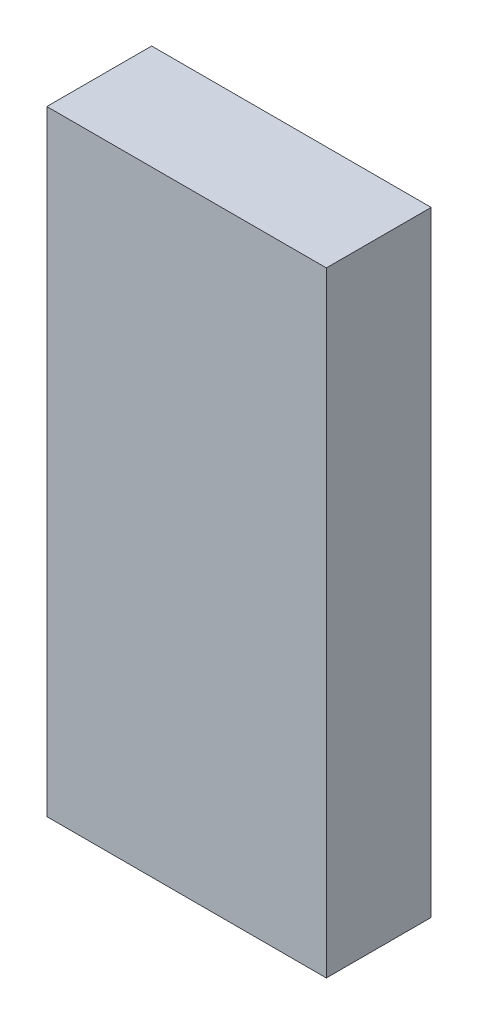
from build123d import *

# Parameters (mm, degrees)
SKETCH_1_W      = 4
SKETCH_1_H      = 8.8
EXTRUDE_1_DEPTH = 1.5


with BuildPart() as part:
    # Эскиз1 → Бобышка-Вытянуть1 (new body)
    with BuildSketch(Plane.XY):
        with Locations((1.416393442, 0.373834133)):
            Rectangle(SKETCH_1_W, SKETCH_1_H)
    extrude(amount=EXTRUDE_1_DEPTH)


solid = part.part
